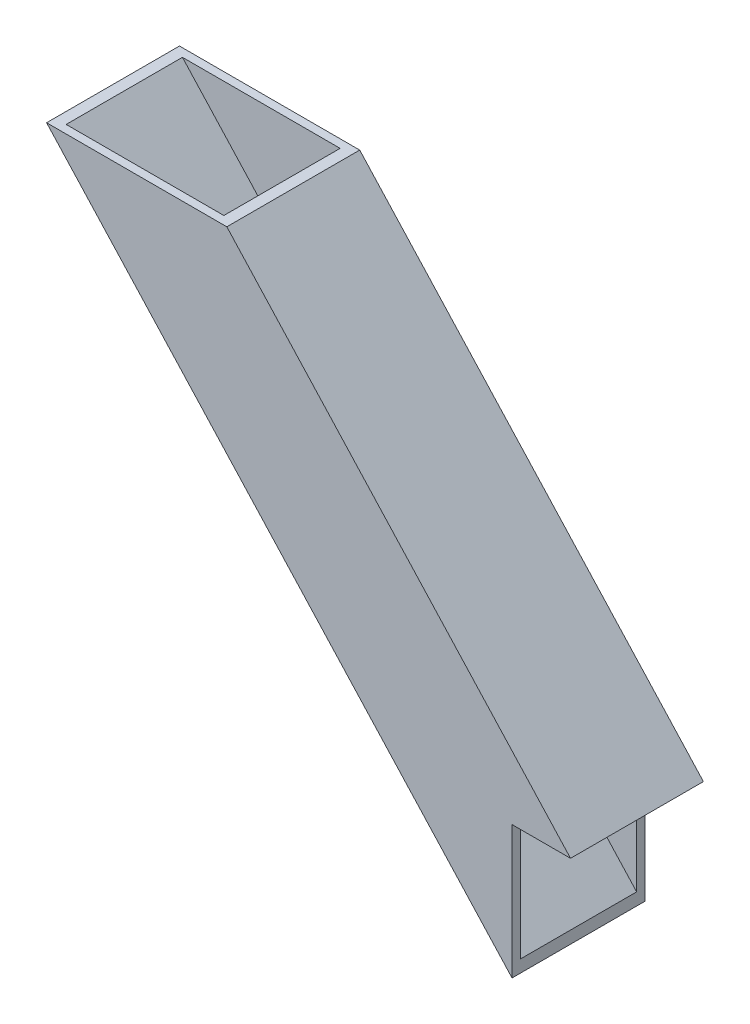
from build123d import *

# Parameters (mm, degrees)
BOSS_EXTRUDE1_DEPTH = 50.8
SKETCH14_W          = 60.289388783
SKETCH14_H          = 44.45


with BuildPart() as part:
    # Sketch1 → Boss-Extrude1 (new body)
    with BuildSketch(Plane.XY):
        Polygon((-6.329511048, -89.779515299), (-184.2678796, 104.406138968), (-115.365720991, 104.406138968), (16.023023921, -38.979515299), (-6.329511048, -38.979515299), align=None)
    extrude(amount=BOSS_EXTRUDE1_DEPTH)

    # Cut-Sweep1: sweep along a path in Sketch13
    with BuildLine(Plane.XY.offset(25.4)) as cut_sweep1_path:
        Line((-149.816800296, 104.406138968), (41.274977184, -104.133942279))
    # Sketch14 → Cut-Sweep1 (sweep, cut)
    with BuildSketch(Plane(origin=(0, 104.406138968, 0), x_dir=(1, 0, 0), z_dir=(0, 1, 0))):
        with Locations((-149.816800296, -25.4)):
            Rectangle(SKETCH14_W, SKETCH14_H)
    sweep(path=cut_sweep1_path.line, mode=Mode.SUBTRACT)


solid = part.part
